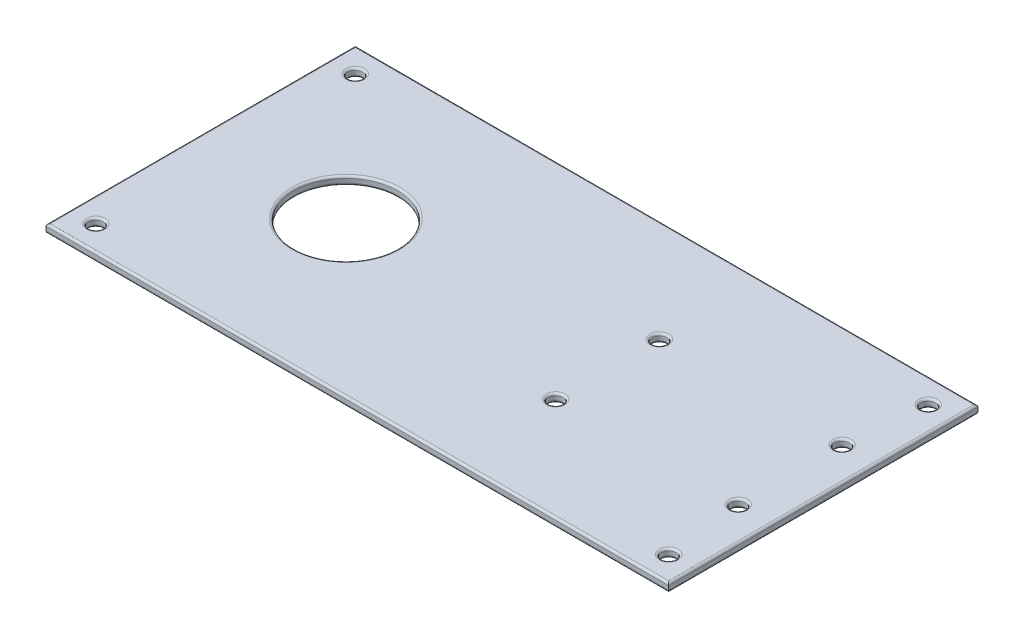
from build123d import *

# Parameters (mm, degrees)
SKETCH1_W           = 150
SKETCH1_H           = 74.5
SKETCH1_R           = 1.75
SKETCH1_R_2         = 12.5
BOSS_EXTRUDE1_DEPTH = 2
FILLET1_R           = 0.5


with BuildPart() as part:
    # Sketch1 → Boss-Extrude1 (new body)
    with BuildSketch(Plane(origin=(0, 0, 0), x_dir=(1, 0, 0), z_dir=(0, 1, 0))):
        with Locations((75, 37.25)):
            Rectangle(SKETCH1_W, SKETCH1_H)
        with Locations(Location((144, 6, 0), (0, 0, 270))):
            Circle(SKETCH1_R, mode=Mode.SUBTRACT)
        with Locations(Location((144, 68.5, 0), (0, 0, 270))):
            Circle(SKETCH1_R, mode=Mode.SUBTRACT)
        with Locations(Location((35, 37.25, 0), (0, 0, 270))):
            Circle(SKETCH1_R_2, mode=Mode.SUBTRACT)
        with Locations(Location((6, 68.5, 0), (0, 0, 270))):
            Circle(SKETCH1_R, mode=Mode.SUBTRACT)
        with Locations(Location((6, 6, 0), (0, 0, 270))):
            Circle(SKETCH1_R, mode=Mode.SUBTRACT)
        with Locations(Location((98, 49.75, 0), (0, 0, 270))):
            Circle(SKETCH1_R, mode=Mode.SUBTRACT)
        with Locations(Location((142, 49.75, 0), (0, 0, 270))):
            Circle(SKETCH1_R, mode=Mode.SUBTRACT)
        with Locations(Location((142, 24.75, 0), (0, 0, 270))):
            Circle(SKETCH1_R, mode=Mode.SUBTRACT)
        with Locations(Location((98, 24.75, 0), (0, 0, 270))):
            Circle(SKETCH1_R, mode=Mode.SUBTRACT)
    extrude(amount=BOSS_EXTRUDE1_DEPTH)

    # Fillet1
    fillet1_edges = [part.edges().sort_by_distance(p)[0] for p in [
        (144, 0, -7.75),
        (144, 2, -7.75),
        (150, 2, -37.25),
        (144, 0, -70.25),
        (144, 2, -70.25),
        (75, 2, -74.5),
        (35, 0, -49.75),
        (35, 2, -49.75),
        (6, 0, -70.25),
        (6, 2, -70.25),
        (6, 0, -7.75),
        (6, 2, -7.75),
        (98, 0, -51.5),
        (98, 2, -51.5),
        (142, 0, -51.5),
        (142, 2, -51.5),
        (142, 0, -26.5),
        (142, 2, -26.5),
        (98, 0, -26.5),
        (98, 2, -26.5),
        (0, 2, -37.25),
        (75, 0, -74.5),
        (150, 0, -37.25),
        (75, 0, 0),
        (0, 0, -37.25),
        (75, 2, 0),
    ]]
    fillet(fillet1_edges, radius=FILLET1_R)


solid = part.part
